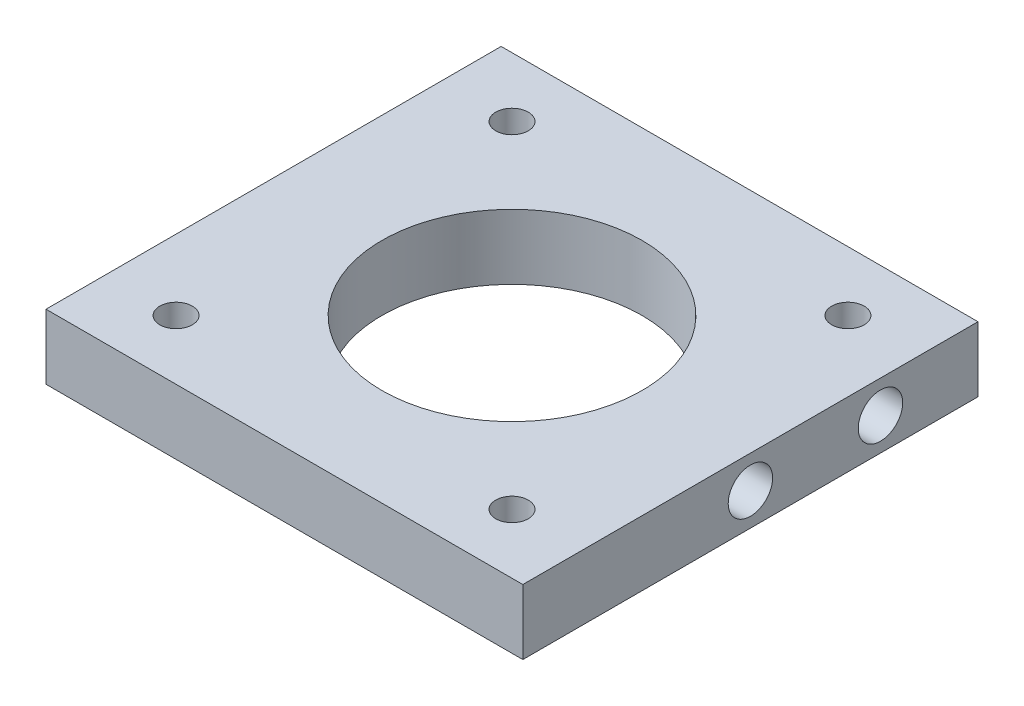
from build123d import *

# Parameters (mm, degrees)
SKETCH1_W           = 44
SKETCH1_H           = 6
BOSS_EXTRUDE1_DEPTH = 42
CUT_EXTRUDE4_REACH  = 49.791
SKETCH5_R           = 12
SKETCH5_R_2         = 1.5
SKETCH6_R           = 2.05
CUT_EXTRUDE5_DEPTH  = 6
CUT_EXTRUDE6_START  = -6
SKETCH7_R           = 2.05
CUT_EXTRUDE6_DEPTH  = 6


with BuildPart() as part:
    # Sketch1 → Boss-Extrude1 (new body)
    with BuildSketch(Plane.XY):
        Rectangle(SKETCH1_W, SKETCH1_H)
    extrude(amount=BOSS_EXTRUDE1_DEPTH)

    # Sketch5 → Cut-Extrude4 (cut, up to next)
    with BuildSketch(Plane(origin=(0, 3, 0), x_dir=(1, 0, 0), z_dir=(0, 1, 0)), mode=Mode.PRIVATE) as cut_extrude4_sk1:
        with Locations(Location((0, -21, 0), (0, 0, 270))):
            Circle(SKETCH5_R)
    cut_extrude4_tool1 = extrude(cut_extrude4_sk1.sketch, amount=-CUT_EXTRUDE4_REACH, mode=Mode.PRIVATE) & part.part
    # Sketch5 → Cut-Extrude4 (cut, up to next)
    with BuildSketch(Plane(origin=(0, 3, 0), x_dir=(1, 0, 0), z_dir=(0, 1, 0)), mode=Mode.PRIVATE) as cut_extrude4_sk2:
        with Locations(Location((-15.5, -5.5, 0), (0, 0, 270))):
            Circle(SKETCH5_R_2)
    cut_extrude4_tool2 = extrude(cut_extrude4_sk2.sketch, amount=-CUT_EXTRUDE4_REACH, mode=Mode.PRIVATE) & part.part
    # Sketch5 → Cut-Extrude4 (cut, up to next)
    with BuildSketch(Plane(origin=(0, 3, 0), x_dir=(1, 0, 0), z_dir=(0, 1, 0)), mode=Mode.PRIVATE) as cut_extrude4_sk3:
        with Locations(Location((15.5, -5.5, 0), (0, 0, 270))):
            Circle(SKETCH5_R_2)
    cut_extrude4_tool3 = extrude(cut_extrude4_sk3.sketch, amount=-CUT_EXTRUDE4_REACH, mode=Mode.PRIVATE) & part.part
    # Sketch5 → Cut-Extrude4 (cut, up to next)
    with BuildSketch(Plane(origin=(0, 3, 0), x_dir=(1, 0, 0), z_dir=(0, 1, 0)), mode=Mode.PRIVATE) as cut_extrude4_sk4:
        with Locations(Location((15.5, -36.5, 0), (0, 0, 270))):
            Circle(SKETCH5_R_2)
    cut_extrude4_tool4 = extrude(cut_extrude4_sk4.sketch, amount=-CUT_EXTRUDE4_REACH, mode=Mode.PRIVATE) & part.part
    # Sketch5 → Cut-Extrude4 (cut, up to next)
    with BuildSketch(Plane(origin=(0, 3, 0), x_dir=(1, 0, 0), z_dir=(0, 1, 0)), mode=Mode.PRIVATE) as cut_extrude4_sk5:
        with Locations(Location((-15.5, -36.5, 0), (0, 0, 270))):
            Circle(SKETCH5_R_2)
    cut_extrude4_tool5 = extrude(cut_extrude4_sk5.sketch, amount=-CUT_EXTRUDE4_REACH, mode=Mode.PRIVATE) & part.part
    add(cut_extrude4_tool1.solids().sort_by_distance((0, 3, 21))[0], mode=Mode.SUBTRACT)
    add(cut_extrude4_tool2.solids().sort_by_distance((-15.5, 3, 5.5))[0], mode=Mode.SUBTRACT)
    add(cut_extrude4_tool3.solids().sort_by_distance((15.5, 3, 5.5))[0], mode=Mode.SUBTRACT)
    add(cut_extrude4_tool4.solids().sort_by_distance((15.5, 3, 36.5))[0], mode=Mode.SUBTRACT)
    add(cut_extrude4_tool5.solids().sort_by_distance((-15.5, 3, 36.5))[0], mode=Mode.SUBTRACT)

    # Sketch6 → Cut-Extrude5 (cut)
    with BuildSketch(Plane.ZY.offset(22)):
        with Locations(Location((9, 0, 0), (0, 0, 270))):
            Circle(SKETCH6_R)
        with Locations(Location((21, 0, 0), (0, 0, 270))):
            Circle(SKETCH6_R)
    extrude(amount=-CUT_EXTRUDE5_DEPTH, mode=Mode.SUBTRACT)

    # Sketch7 → Cut-Extrude6 (cut)
    with BuildSketch(Plane(origin=(22, 0, 0), x_dir=(0, 0, -1), z_dir=(1, 0, 0)).offset(CUT_EXTRUDE6_START)):
        with Locations(Location((-9, 0, 0), (0, 0, 270))):
            Circle(SKETCH7_R)
        with Locations(Location((-21, 0, 0), (0, 0, 270))):
            Circle(SKETCH7_R)
    extrude(amount=CUT_EXTRUDE6_DEPTH, mode=Mode.SUBTRACT)


solid = part.part
